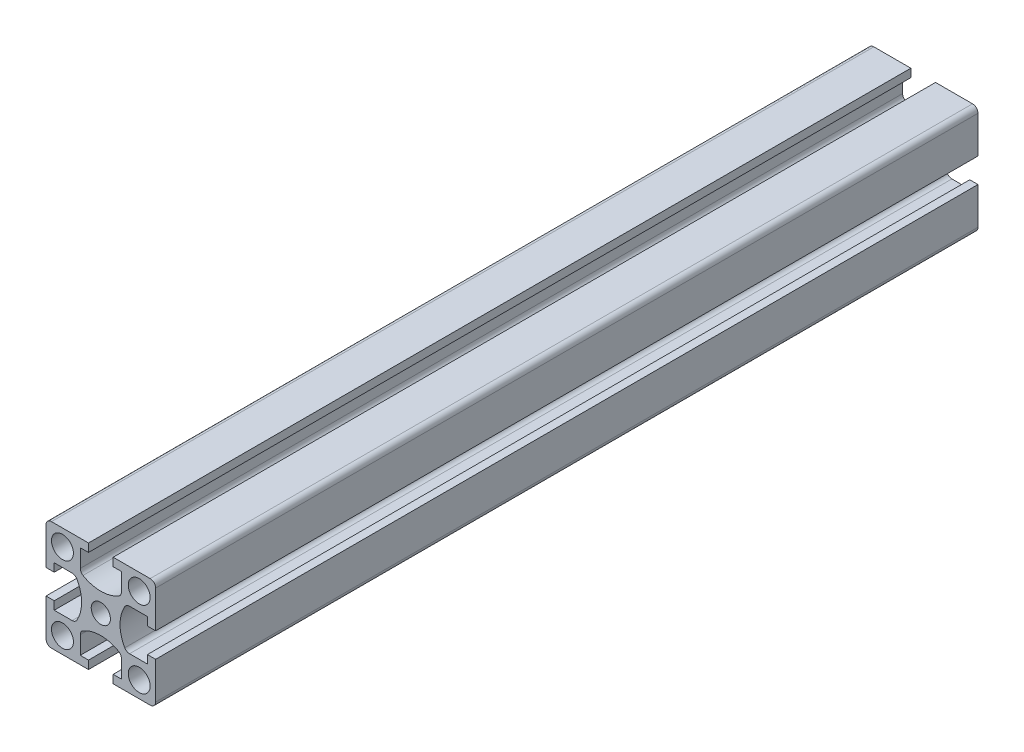
from build123d import *

# Parameters (mm, degrees)
SKETCH1_R           = 2
SKETCH1_R_2         = 1.75
BOSS_EXTRUDE1_DEPTH = 150


with BuildPart() as part:
    # Sketch1 → Boss-Extrude1 (new body)
    with BuildSketch(Plane.XY):
        with BuildLine():
            Line((-10, 9), (-10, 2.25))
            Line((-10, 2.25), (-8.5, 2.25))
            Line((-8.5, 2.25), (-8.5, 3.75))
            Line((-8.5, 3.75), (-5.236860279, 3.75))
            ThreePointArc((-5.236860279, 3.75), (-4.736860279, 3.616025404), (-4.370834875, 3.25))
            ThreePointArc((-4.370834875, 3.25), (-3.5, 0), (-4.370834875, -3.25))
            ThreePointArc((-4.370834875, -3.25), (-4.736860279, -3.616025404), (-5.236860279, -3.75))
            Line((-5.236860279, -3.75), (-8.5, -3.75))
            Line((-8.5, -3.75), (-8.5, -2.25))
            Line((-8.5, -2.25), (-10, -2.25))
            Line((-10, -2.25), (-10, -9))
            ThreePointArc((-10, -9), (-9.707106781, -9.707106781), (-9, -10))
            Line((-9, -10), (-2.25, -10))
            Line((-2.25, -10), (-2.25, -8.5))
            Line((-2.25, -8.5), (-3.75, -8.5))
            Line((-3.75, -8.5), (-3.75, -5.236860279))
            ThreePointArc((-3.75, -5.236860279), (-3.616025404, -4.736860279), (-3.25, -4.370834875))
            ThreePointArc((-3.25, -4.370834875), (0, -3.5), (3.25, -4.370834875))
            ThreePointArc((3.25, -4.370834875), (3.616025404, -4.736860279), (3.75, -5.236860279))
            Line((3.75, -5.236860279), (3.75, -8.5))
            Line((3.75, -8.5), (2.25, -8.5))
            Line((2.25, -8.5), (2.25, -10))
            Line((2.25, -10), (9, -10))
            ThreePointArc((9, -10), (9.707106781, -9.707106781), (10, -9))
            Line((10, -9), (10, -2.25))
            Line((10, -2.25), (8.5, -2.25))
            Line((8.5, -2.25), (8.5, -3.75))
            Line((8.5, -3.75), (5.236860279, -3.75))
            ThreePointArc((5.236860279, -3.75), (4.736860279, -3.616025404), (4.370834875, -3.25))
            ThreePointArc((4.370834875, -3.25), (3.5, 0), (4.370834875, 3.25))
            ThreePointArc((4.370834875, 3.25), (4.736860279, 3.616025404), (5.236860279, 3.75))
            Line((5.236860279, 3.75), (8.5, 3.75))
            Line((8.5, 3.75), (8.5, 2.25))
            Line((8.5, 2.25), (10, 2.25))
            Line((10, 2.25), (10, 9))
            ThreePointArc((10, 9), (9.707106781, 9.707106781), (9, 10))
            Line((9, 10), (2.25, 10))
            Line((2.25, 10), (2.25, 8.5))
            Line((2.25, 8.5), (3.75, 8.5))
            Line((3.75, 8.5), (3.75, 5.236860279))
            ThreePointArc((3.75, 5.236860279), (3.616025404, 4.736860279), (3.25, 4.370834875))
            ThreePointArc((3.25, 4.370834875), (0, 3.5), (-3.25, 4.370834875))
            ThreePointArc((-3.25, 4.370834875), (-3.616025404, 4.736860279), (-3.75, 5.236860279))
            Line((-3.75, 5.236860279), (-3.75, 8.5))
            Line((-3.75, 8.5), (-2.25, 8.5))
            Line((-2.25, 8.5), (-2.25, 10))
            Line((-2.25, 10), (-9, 10))
            ThreePointArc((-9, 10), (-9.707106781, 9.707106781), (-10, 9))
        make_face()
        with Locations((-7, -7)):
            Circle(SKETCH1_R, mode=Mode.SUBTRACT)
        with Locations((7, -7)):
            Circle(SKETCH1_R, mode=Mode.SUBTRACT)
        with Locations((7, 7)):
            Circle(SKETCH1_R, mode=Mode.SUBTRACT)
        Circle(SKETCH1_R_2, mode=Mode.SUBTRACT)
        with Locations((-7, 7)):
            Circle(SKETCH1_R, mode=Mode.SUBTRACT)
    extrude(amount=BOSS_EXTRUDE1_DEPTH)


solid = part.part
